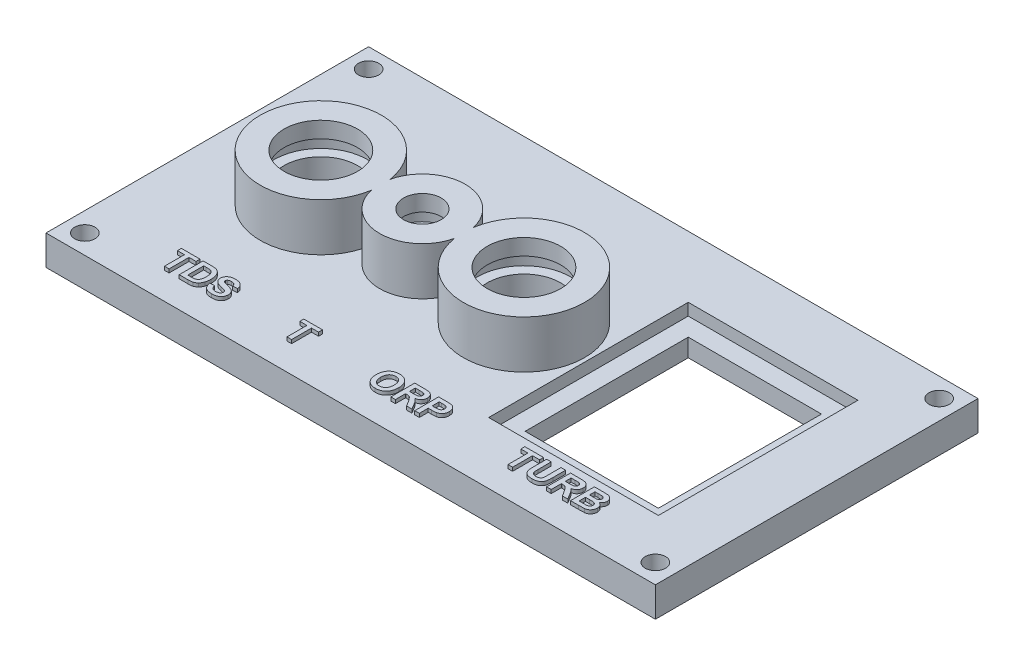
from build123d import *

# Parameters (mm, degrees)
SKETCH1_W                 = 102
SKETCH1_H                 = 54
CAP_PLATE_DEPTH           = 5
COLLAR_TDS_START          = 5
SKETCH2_R                 = 10.15
COLLAR_TDS_DEPTH          = 8
COLLAR_T_START            = 5
SKETCH3_R                 = 7.15
COLLAR_T_DEPTH            = 8
COLLAR_ORP_START          = 5
SKETCH4_R                 = 10.15
COLLAR_ORP_DEPTH          = 8
PORT_TDS_DEPTH            = 60.152345685
PORT_TDS_DEPTH_BACK       = 60.152345685
SKETCH5_R                 = 6.15
ORING_GROOVE_TDS_START    = 7.7
SKETCH6_R                 = 7.85
ORING_GROOVE_TDS_DEPTH    = 2.6
PORT_T_DEPTH              = 60.152345685
PORT_T_DEPTH_BACK         = 60.152345685
SKETCH7_R                 = 3.15
ORING_GROOVE_T_START      = 7.7
SKETCH8_R                 = 4.85
ORING_GROOVE_T_DEPTH      = 2.6
PORT_ORP_DEPTH            = 60.152345685
PORT_ORP_DEPTH_BACK       = 60.152345685
SKETCH9_R                 = 6.15
ORING_GROOVE_ORP_START    = 7.7
SKETCH10_R                = 7.85
ORING_GROOVE_ORP_DEPTH    = 2.6
PORT_TURB_DEPTH           = 60.152345685
PORT_TURB_DEPTH_BACK      = 60.152345685
SKETCH11_W                = 22.3
SKETCH11_H                = 27.3
TURB_GASKET_SEAT_START    = 5
SKETCH12_W                = 28.4
SKETCH12_H                = 33.4
TURB_GASKET_SEAT_DEPTH    = 2
SCREW_HOLES_M3_DEPTH      = 60.152345685
SCREW_HOLES_M3_DEPTH_BACK = 60.152345685
SKETCH13_R                = 1.7
LABEL_TDS_START           = 5
LABEL_TDS_DEPTH           = 0.6
LABEL_T_START             = 5
LABEL_T_DEPTH             = 0.6
LABEL_ORP_START           = 5
LABEL_ORP_DEPTH           = 0.6
LABEL_TURB_START          = 5
LABEL_TURB_DEPTH          = 0.6


with BuildPart() as part:
    # Sketch1 → Cap_Plate (new body)
    with BuildSketch(Plane(origin=(0, 0, 0), x_dir=(1, 0, 0), z_dir=(0, 1, 0))):
        Rectangle(SKETCH1_W, SKETCH1_H)
    extrude(amount=CAP_PLATE_DEPTH)

    # Sketch2 → Collar_TDS (add)
    with BuildSketch(Plane(origin=(0, 0, 0), x_dir=(1, 0, 0), z_dir=(0, 1, 0)).offset(COLLAR_TDS_START)):
        with Locations(Location((-32, 0, 0), (0, 0, 270))):
            Circle(SKETCH2_R)
    extrude(amount=COLLAR_TDS_DEPTH)

    # Sketch3 → Collar_T (add)
    with BuildSketch(Plane(origin=(0, 0, 0), x_dir=(1, 0, 0), z_dir=(0, 1, 0)).offset(COLLAR_T_START)):
        with Locations((-15, 0)):
            Circle(SKETCH3_R)
    extrude(amount=COLLAR_T_DEPTH)

    # Sketch4 → Collar_ORP (add)
    with BuildSketch(Plane(origin=(0, 0, 0), x_dir=(1, 0, 0), z_dir=(0, 1, 0)).offset(COLLAR_ORP_START)):
        with Locations((2, 0)):
            Circle(SKETCH4_R)
    extrude(amount=COLLAR_ORP_DEPTH)

    # Sketch5 → Port_TDS (cut, two sides: drawn at the far end of the back side and taken through both)
    with BuildSketch(Plane(origin=(0, 0, 0), x_dir=(1, 0, 0), z_dir=(0, 1, 0)).offset(-PORT_TDS_DEPTH_BACK)):
        with Locations(Location((-32, 0, 0), (0, 0, 270))):
            Circle(SKETCH5_R)
    extrude(amount=PORT_TDS_DEPTH + PORT_TDS_DEPTH_BACK, mode=Mode.SUBTRACT)

    # Sketch6 → ORing_Groove_TDS (cut)
    with BuildSketch(Plane(origin=(0, 0, 0), x_dir=(1, 0, 0), z_dir=(0, 1, 0)).offset(ORING_GROOVE_TDS_START)):
        with Locations(Location((-32, 0, 0), (0, 0, 270))):
            Circle(SKETCH6_R)
    extrude(amount=ORING_GROOVE_TDS_DEPTH, mode=Mode.SUBTRACT)

    # Sketch7 → Port_T (cut, two sides: drawn at the far end of the back side and taken through both)
    with BuildSketch(Plane(origin=(0, 0, 0), x_dir=(1, 0, 0), z_dir=(0, 1, 0)).offset(-PORT_T_DEPTH_BACK)):
        with Locations(Location((-15, 0, 0), (0, 0, 270))):
            Circle(SKETCH7_R)
    extrude(amount=PORT_T_DEPTH + PORT_T_DEPTH_BACK, mode=Mode.SUBTRACT)

    # Sketch8 → ORing_Groove_T (cut)
    with BuildSketch(Plane(origin=(0, 0, 0), x_dir=(1, 0, 0), z_dir=(0, 1, 0)).offset(ORING_GROOVE_T_START)):
        with Locations(Location((-15, 0, 0), (0, 0, 270))):
            Circle(SKETCH8_R)
    extrude(amount=ORING_GROOVE_T_DEPTH, mode=Mode.SUBTRACT)

    # Sketch9 → Port_ORP (cut, two sides: drawn at the far end of the back side and taken through both)
    with BuildSketch(Plane(origin=(0, 0, 0), x_dir=(1, 0, 0), z_dir=(0, 1, 0)).offset(-PORT_ORP_DEPTH_BACK)):
        with Locations(Location((2, 0, 0), (0, 0, 270))):
            Circle(SKETCH9_R)
    extrude(amount=PORT_ORP_DEPTH + PORT_ORP_DEPTH_BACK, mode=Mode.SUBTRACT)

    # Sketch10 → ORing_Groove_ORP (cut)
    with BuildSketch(Plane(origin=(0, 0, 0), x_dir=(1, 0, 0), z_dir=(0, 1, 0)).offset(ORING_GROOVE_ORP_START)):
        with Locations(Location((2, 0, 0), (0, 0, 270))):
            Circle(SKETCH10_R)
    extrude(amount=ORING_GROOVE_ORP_DEPTH, mode=Mode.SUBTRACT)

    # Sketch11 → Port_TURB (cut, two sides: drawn at the far end of the back side and taken through both)
    with BuildSketch(Plane(origin=(0, 0, 0), x_dir=(1, 0, 0), z_dir=(0, 1, 0)).offset(-PORT_TURB_DEPTH_BACK)):
        with Locations((27, 0)):
            Rectangle(SKETCH11_W, SKETCH11_H)
    extrude(amount=PORT_TURB_DEPTH + PORT_TURB_DEPTH_BACK, mode=Mode.SUBTRACT)

    # Sketch12 → TURB_Gasket_Seat (cut)
    with BuildSketch(Plane(origin=(0, 0, 0), x_dir=(1, 0, 0), z_dir=(0, 1, 0)).offset(TURB_GASKET_SEAT_START)):
        with Locations((27, 0)):
            Rectangle(SKETCH12_W, SKETCH12_H)
    extrude(amount=-TURB_GASKET_SEAT_DEPTH, mode=Mode.SUBTRACT)

    # Sketch13 → Screw_Holes_M3 (cut, two sides: drawn at the far end of the back side and taken through both)
    with BuildSketch(Plane(origin=(0, 0, 0), x_dir=(1, 0, 0), z_dir=(0, 1, 0)).offset(-SCREW_HOLES_M3_DEPTH_BACK)):
        with Locations(Location((-47.75, 23.75, 0), (0, 0, 270))):
            Circle(SKETCH13_R)
        with Locations(Location((-47.75, -23.75, 0), (0, 0, 270))):
            Circle(SKETCH13_R)
        with Locations(Location((47.75, 23.75, 0), (0, 0, 270))):
            Circle(SKETCH13_R)
        with Locations(Location((47.75, -23.75, 0), (0, 0, 270))):
            Circle(SKETCH13_R)
    extrude(amount=SCREW_HOLES_M3_DEPTH + SCREW_HOLES_M3_DEPTH_BACK, mode=Mode.SUBTRACT)

    # Sketch14 → Label_TDS (add)
    # profile 1 of 3: a face of its own
    with BuildSketch(Plane(origin=(0, 0, 0), x_dir=(1, 0, 0), z_dir=(0, 1, 0)).offset(LABEL_TDS_START)):
        Polygon((-35.666666667, -22.5), (-35.666666667, -19.166666667), (-36.846153846, -19.166666667), (-36.846153846, -18.5), (-33.717948718, -18.5), (-33.717948718, -19.166666667), (-34.897435897, -19.166666667), (-34.897435897, -22.5), align=None)
    # profile 2 of 3: a face of its own
    with BuildSketch(Plane(origin=(0, 0, 0), x_dir=(1, 0, 0), z_dir=(0, 1, 0)).offset(LABEL_TDS_START)):
        with BuildLine():
            Line((-33.205128205, -18.5), (-31.737980769, -18.5))
            add(Edge.make_bspline(
                [(-31.737980769, -18.5), (-31.697910591, -18.499979227), (-31.619884646, -18.499938778), (-31.506648571, -18.50463643), (-31.400758284, -18.509361651), (-31.302517715, -18.518820508), (-31.211586037, -18.528735069), (-31.127800077, -18.541287648), (-31.051689115, -18.557375153), (-31.003693585, -18.570062074), (-30.980769231, -18.576121795)],
                knots=[0, 0, 0, 0, 1.259756885, 2.453039283, 3.563158368, 4.591894114, 5.55549294, 6.43918076, 7.254497783, 8, 8, 8, 8], degree=3))
            add(Edge.make_bspline(
                [(-30.980769231, -18.576121795), (-30.952100925, -18.585465243), (-30.895280696, -18.603983842), (-30.811980494, -18.636431511), (-30.733057889, -18.676673164), (-30.655584948, -18.718974628), (-30.583020283, -18.768991188), (-30.51152363, -18.821026724), (-30.445735007, -18.881304449), (-30.359461689, -18.965546539), (-30.261017276, -19.082898434), (-30.157881751, -19.238559827), (-30.070587794, -19.40941962), (-30.010944549, -19.562504047), (-29.970671115, -19.69263874), (-29.94434481, -19.796973767), (-29.921982215, -19.90687741), (-29.903622456, -20.022377377), (-29.889357451, -20.143473684), (-29.878737004, -20.270134053), (-29.873563774, -20.402467902), (-29.87239247, -20.49251804), (-29.871794872, -20.538461538)],
                knots=[0, 0, 0, 0, 0.745524535, 1.477620414, 2.207090574, 2.934465325, 3.657932502, 4.384347339, 5.118673636, 5.861150177, 7.365375624, 8.894729774, 10.468936425, 12.099947606, 12.950091786, 13.83580991, 14.759228729, 15.722225242, 16.726454549, 17.773376212, 18.863978586, 20, 20, 20, 20], degree=3))
            add(Edge.make_bspline(
                [(-29.871794872, -20.538461538), (-29.872885763, -20.617866005), (-29.874995525, -20.771432649), (-29.899437251, -20.993028674), (-29.934660866, -21.198851171), (-29.974365187, -21.327252193), (-29.993589744, -21.389423077)],
                knots=[0, 0, 0, 0, 1.103207939, 2.133582005, 3.096293362, 4, 4, 4, 4], degree=3))
            add(Edge.make_bspline(
                [(-29.993589744, -21.389423077), (-30.006284321, -21.425098085), (-30.031256534, -21.495276392), (-30.074956036, -21.596508944), (-30.122173656, -21.692846691), (-30.173301045, -21.784213728), (-30.228596515, -21.870199086), (-30.28826689, -21.950545576), (-30.351387231, -22.026310986), (-30.397114267, -22.072944954), (-30.419871795, -22.096153846)],
                knots=[0, 0, 0, 0, 1.090884612, 2.145940218, 3.175104604, 4.181306866, 5.161203701, 6.118658341, 7.063689906, 8, 8, 8, 8], degree=3))
            add(Edge.make_bspline(
                [(-30.419871795, -22.096153846), (-30.456698973, -22.129272817), (-30.532641864, -22.197568856), (-30.666466244, -22.282087934), (-30.817725425, -22.356771314), (-30.927137068, -22.395134927), (-30.983974359, -22.415064103)],
                knots=[0, 0, 0, 0, 0.908140292, 1.872714733, 2.8949153, 4, 4, 4, 4], degree=3))
            add(Edge.make_bspline(
                [(-30.983974359, -22.415064103), (-31.006854253, -22.422091199), (-31.05434029, -22.436675575), (-31.129634084, -22.452251991), (-31.210012097, -22.468661898), (-31.296401201, -22.47854748), (-31.387904634, -22.488972263), (-31.485251594, -22.494825196), (-31.588104631, -22.498980438), (-31.658649006, -22.499655107), (-31.694711538, -22.5)],
                knots=[0, 0, 0, 0, 0.799129865, 1.658552685, 2.566799617, 3.538529252, 4.561352959, 5.643373779, 6.795284424, 8, 8, 8, 8], degree=3))
            Line((-31.694711538, -22.5), (-33.205128205, -22.5))
            Line((-33.205128205, -22.5), (-33.205128205, -18.5))
        make_face()
        with BuildLine():
            Line((-32.435897436, -19.166666667), (-32.435897436, -21.833333333))
            Line((-32.435897436, -21.833333333), (-31.802884615, -21.833333333))
            add(Edge.make_bspline(
                [(-31.802884615, -21.833333333), (-31.774305746, -21.833106683), (-31.719280505, -21.832670296), (-31.639657572, -21.831388023), (-31.566484766, -21.827916668), (-31.499378764, -21.82432091), (-31.438514268, -21.818380089), (-31.383626448, -21.812537065), (-31.335020835, -21.804362797), (-31.305000814, -21.797910138), (-31.290865385, -21.794871795)],
                knots=[0, 0, 0, 0, 1.333384787, 2.567275092, 3.714769766, 4.750907381, 5.701951617, 6.567520054, 7.325492842, 8, 8, 8, 8], degree=3))
            add(Edge.make_bspline(
                [(-31.290865385, -21.794871795), (-31.257758607, -21.786037264), (-31.193275336, -21.768829929), (-31.102734305, -21.730469825), (-31.020806336, -21.684192558), (-30.946119388, -21.628546133), (-30.878810988, -21.558221922), (-30.82135504, -21.46828277), (-30.768181074, -21.361017644), (-30.731767531, -21.258338093), (-30.705629958, -21.166627119), (-30.687936966, -21.089651835), (-30.673954673, -21.006372362), (-30.661928077, -20.917117374), (-30.652210302, -20.822001647), (-30.646163442, -20.720681703), (-30.642036423, -20.613281569), (-30.641368951, -20.539534109), (-30.641025641, -20.501602564)],
                knots=[0, 0, 0, 0, 1.038686998, 2.023088296, 2.974059649, 3.888265163, 4.839857954, 5.909819677, 7.113156087, 8.466843969, 9.20827164, 10.006482943, 10.861893492, 11.769681931, 12.739021491, 13.762258324, 14.849031541, 16, 16, 16, 16], degree=3))
            add(Edge.make_bspline(
                [(-30.641025641, -20.501602564), (-30.641366311, -20.463670902), (-30.642026253, -20.390190127), (-30.646146942, -20.283590818), (-30.652159836, -20.183866382), (-30.661946818, -20.090893542), (-30.673786982, -20.004543806), (-30.687933054, -19.924744099), (-30.70551939, -19.852018124), (-30.731679194, -19.765618322), (-30.771336109, -19.668502261), (-30.825301432, -19.562320812), (-30.891572705, -19.471819372), (-30.964796008, -19.393199293), (-31.049223715, -19.32849894), (-31.142684981, -19.274308626), (-31.247214727, -19.232248233), (-31.32157002, -19.214333332), (-31.359775641, -19.205128205)],
                knots=[0, 0, 0, 0, 1.117996097, 2.165769068, 3.143980016, 4.062055362, 4.920439205, 5.712587309, 6.449616741, 7.124491204, 8.371470382, 9.537068822, 10.625202851, 11.666538334, 12.693249444, 13.747832046, 14.842779399, 16, 16, 16, 16], degree=3))
            add(Edge.make_bspline(
                [(-31.359775641, -19.205128205), (-31.376312895, -19.202055352), (-31.412721599, -19.195290105), (-31.473138339, -19.187388257), (-31.544020637, -19.181524411), (-31.625729838, -19.175537939), (-31.717935093, -19.172121049), (-31.821022212, -19.16855497), (-31.934559823, -19.167336804), (-32.013889173, -19.166896465), (-32.055288462, -19.166666667)],
                knots=[0, 0, 0, 0, 0.578738571, 1.274160813, 2.095454135, 3.025967819, 4.093109015, 5.270126069, 6.575371698, 8, 8, 8, 8], degree=3))
            Line((-32.055288462, -19.166666667), (-32.435897436, -19.166666667))
        make_face(mode=Mode.SUBTRACT)
    # profile 3 of 3: a face of its own
    with BuildSketch(Plane(origin=(0, 0, 0), x_dir=(1, 0, 0), z_dir=(0, 1, 0)).offset(LABEL_TDS_START)):
        with BuildLine():
            Line((-29.41025641, -21.166666667), (-28.641025641, -21.115384615))
            add(Edge.make_bspline(
                [(-28.641025641, -21.115384615), (-28.634897397, -21.147566522), (-28.622993674, -21.210077828), (-28.596545835, -21.299164975), (-28.567434084, -21.382219461), (-28.532643946, -21.458350668), (-28.494557631, -21.528965837), (-28.450046335, -21.592053313), (-28.402215278, -21.649627318), (-28.34869673, -21.69962004), (-28.290388967, -21.743404357), (-28.227001039, -21.780745081), (-28.159219808, -21.813064152), (-28.086879541, -21.839677882), (-28.009234662, -21.859545162), (-27.92696157, -21.873679553), (-27.839942272, -21.882730827), (-27.780471511, -21.883976916), (-27.75, -21.884615385)],
                knots=[0, 0, 0, 0, 1.204560339, 2.339781841, 3.415289417, 4.440034832, 5.416475564, 6.362424008, 7.275913008, 8.16578645, 9.05021719, 9.95355393, 10.867835453, 11.809845306, 12.784702352, 13.812224031, 14.87903166, 16, 16, 16, 16], degree=3))
            add(Edge.make_bspline(
                [(-27.75, -21.884615385), (-27.717926807, -21.884265468), (-27.655542795, -21.883584862), (-27.565141463, -21.875141351), (-27.480612111, -21.863045113), (-27.402701164, -21.843897052), (-27.329953708, -21.822482975), (-27.264176489, -21.793186236), (-27.204305073, -21.759396683), (-27.150493703, -21.721054296), (-27.103532471, -21.678529837), (-27.062448441, -21.634135682), (-27.026666965, -21.588830946), (-26.998504411, -21.540605206), (-26.975712834, -21.491408909), (-26.960649197, -21.439774444), (-26.950472819, -21.386887451), (-26.949305885, -21.350742796), (-26.948717949, -21.332532051)],
                knots=[0, 0, 0, 0, 1.417779877, 2.757654889, 4.012140507, 5.189587551, 6.302846416, 7.360586765, 8.365575446, 9.33904572, 10.275781718, 11.161696098, 12.012180333, 12.822428111, 13.625933072, 14.403138519, 15.195454004, 16, 16, 16, 16], degree=3))
            add(Edge.make_bspline(
                [(-26.948717949, -21.332532051), (-26.949439002, -21.309715465), (-26.950849637, -21.265078153), (-26.967832275, -21.201264225), (-26.993300473, -21.142142465), (-27.03164678, -21.088586101), (-27.083193655, -21.03964339), (-27.14894683, -20.993858682), (-27.230741704, -20.952670351), (-27.29142286, -20.929695424), (-27.323717949, -20.917467949)],
                knots=[0, 0, 0, 0, 0.90494901, 1.770400303, 2.607161909, 3.452839393, 4.36912122, 5.420987164, 6.627424851, 8, 8, 8, 8], degree=3))
            add(Edge.make_bspline(
                [(-27.323717949, -20.917467949), (-27.337574916, -20.912824415), (-27.368584558, -20.902432941), (-27.421483716, -20.887574113), (-27.485202156, -20.869019384), (-27.560660651, -20.847928973), (-27.647833829, -20.826359034), (-27.745748078, -20.799787317), (-27.855597082, -20.773346287), (-27.932447577, -20.753827525), (-27.97275641, -20.743589744)],
                knots=[0, 0, 0, 0, 0.521821638, 1.167752076, 1.961721917, 2.891982557, 3.96540661, 5.168436773, 6.514817513, 8, 8, 8, 8], degree=3))
            add(Edge.make_bspline(
                [(-27.97275641, -20.743589744), (-28.025250474, -20.730483201), (-28.126529187, -20.70519627), (-28.270975823, -20.660212611), (-28.404013817, -20.615518856), (-28.524362228, -20.567023734), (-28.633348548, -20.518013888), (-28.729209892, -20.465048504), (-28.813946676, -20.410878263), (-28.863324766, -20.370390101), (-28.887019231, -20.350961538)],
                knots=[0, 0, 0, 0, 1.293880989, 2.496331788, 3.617634808, 4.64976062, 5.598842568, 6.473791081, 7.267636666, 8, 8, 8, 8], degree=3))
            add(Edge.make_bspline(
                [(-28.887019231, -20.350961538), (-28.916403447, -20.323449223), (-28.974013919, -20.269508786), (-29.049849165, -20.180874294), (-29.113571421, -20.087246136), (-29.166021814, -19.98931541), (-29.206407624, -19.886518334), (-29.235032567, -19.77954299), (-29.253559671, -19.668110183), (-29.255450234, -19.592221801), (-29.256410256, -19.553685897)],
                knots=[0, 0, 0, 0, 1.064429417, 2.086912298, 3.078678339, 4.055528992, 5.020032834, 5.993708893, 6.981211098, 8, 8, 8, 8], degree=3))
            add(Edge.make_bspline(
                [(-29.256410256, -19.553685897), (-29.254540605, -19.503820898), (-29.250831774, -19.404903623), (-29.216819378, -19.259508732), (-29.163837358, -19.11921386), (-29.102390778, -19.007814536), (-29.043353872, -18.923540527), (-28.99432802, -18.863066269), (-28.940468384, -18.806468177), (-28.881037203, -18.755126858), (-28.818241303, -18.706034956), (-28.74964773, -18.66244076), (-28.677201318, -18.621377439), (-28.572363107, -18.572698782), (-28.430021583, -18.52197084), (-28.244827614, -18.479210404), (-28.043188053, -18.453505859), (-27.903390725, -18.450352455), (-27.830929487, -18.448717949)],
                knots=[0, 0, 0, 0, 1.180131776, 2.341029169, 3.518901375, 4.725685298, 5.343762192, 5.955650671, 6.568945152, 7.192346361, 7.815201106, 8.455999361, 9.116257477, 9.787318263, 11.192748436, 12.688084276, 14.283332633, 16, 16, 16, 16], degree=3))
            add(Edge.make_bspline(
                [(-27.830929487, -18.448717949), (-27.771598165, -18.449511357), (-27.656200011, -18.45105452), (-27.488916982, -18.466659226), (-27.332665557, -18.490946107), (-27.18799404, -18.52580981), (-27.054835025, -18.571873913), (-26.932672348, -18.626744969), (-26.821609817, -18.691890681), (-26.72299951, -18.767684898), (-26.635147179, -18.851243161), (-26.558510069, -18.942513034), (-26.492795183, -19.040341837), (-26.437578405, -19.144658076), (-26.394216814, -19.255998089), (-26.362369438, -19.374222945), (-26.341305307, -19.499054373), (-26.336025518, -19.584590115), (-26.333333333, -19.628205128)],
                knots=[0, 0, 0, 0, 1.325124071, 2.577337985, 3.749592149, 4.855247722, 5.896868755, 6.892903601, 7.842551483, 8.766257401, 9.665194363, 10.546067736, 11.423174165, 12.293291263, 13.177512979, 14.086532529, 15.024315359, 16, 16, 16, 16], degree=3))
            Line((-26.333333333, -19.628205128), (-27.102564103, -19.679487179))
            add(Edge.make_bspline(
                [(-27.102564103, -19.679487179), (-27.107001601, -19.655366166), (-27.115649823, -19.608356818), (-27.134453426, -19.541029882), (-27.155662978, -19.478760145), (-27.18048766, -19.421548007), (-27.210472877, -19.370418192), (-27.243105409, -19.323762129), (-27.279285441, -19.282201483), (-27.320210906, -19.246874318), (-27.364475431, -19.214728047), (-27.414921389, -19.188962066), (-27.469435039, -19.165056907), (-27.530090295, -19.14708609), (-27.595722356, -19.132830992), (-27.666369452, -19.122263189), (-27.742178024, -19.117103393), (-27.794331528, -19.115970657), (-27.821314103, -19.115384615)],
                knots=[0, 0, 0, 0, 1.151066407, 2.24330871, 3.278475654, 4.238599069, 5.165719782, 6.056502506, 6.909492653, 7.744782051, 8.590364415, 9.471203867, 10.39832458, 11.382154319, 12.435022857, 13.550631277, 14.73277401, 16, 16, 16, 16], degree=3))
            add(Edge.make_bspline(
                [(-27.821314103, -19.115384615), (-27.849368612, -19.115901994), (-27.903949913, -19.116908577), (-27.983489417, -19.123085828), (-28.058103439, -19.134488439), (-28.12815843, -19.14933181), (-28.193560813, -19.16952519), (-28.254172569, -19.194147708), (-28.310271002, -19.223135992), (-28.344477381, -19.245942974), (-28.361378205, -19.257211538)],
                knots=[0, 0, 0, 0, 1.186678824, 2.308736671, 3.37120409, 4.377216403, 5.334874112, 6.262130804, 7.141346615, 8, 8, 8, 8], degree=3))
            add(Edge.make_bspline(
                [(-28.361378205, -19.257211538), (-28.38071978, -19.272604718), (-28.418178406, -19.302416529), (-28.458491815, -19.36161265), (-28.48276058, -19.428472893), (-28.485681602, -19.475754314), (-28.487179487, -19.5)],
                knots=[0, 0, 0, 0, 1.037857257, 2.010007357, 2.979541333, 4, 4, 4, 4], degree=3))
            add(Edge.make_bspline(
                [(-28.487179487, -19.5), (-28.48595449, -19.522659203), (-28.48354144, -19.567294227), (-28.459202724, -19.630699244), (-28.421773096, -19.689448553), (-28.386801247, -19.721361948), (-28.368589744, -19.737980769)],
                knots=[0, 0, 0, 0, 0.98538058, 1.941042925, 2.927803204, 4, 4, 4, 4], degree=3))
            add(Edge.make_bspline(
                [(-28.368589744, -19.737980769), (-28.354136569, -19.748767218), (-28.321839739, -19.772870441), (-28.26267835, -19.803507918), (-28.191269, -19.836690157), (-28.105983729, -19.869129458), (-28.007389341, -19.901508544), (-27.895479841, -19.935316053), (-27.770186398, -19.969577459), (-27.634702682, -20.002757953), (-27.497148552, -20.035372472), (-27.365884435, -20.071029347), (-27.243827683, -20.105792043), (-27.131544239, -20.142228989), (-27.0284553, -20.177700243), (-26.935061638, -20.214131775), (-26.850721975, -20.249612011), (-26.752372578, -20.298399849), (-26.640903428, -20.364484947), (-26.524071185, -20.460550658), (-26.420747974, -20.568534792), (-26.348755106, -20.670356382), (-26.299299773, -20.757925658), (-26.267455757, -20.827728568), (-26.239908185, -20.901283234), (-26.217484537, -20.97867094), (-26.201232787, -21.060000579), (-26.187783519, -21.144650792), (-26.180912038, -21.233324619), (-26.179967244, -21.293793859), (-26.179487179, -21.324519231)],
                knots=[0, 0, 0, 0, 0.511875881, 1.143829537, 1.88775736, 2.750598373, 3.734912702, 4.837306479, 6.073130119, 7.42648979, 8.801963576, 10.091065733, 11.292408984, 12.408830014, 13.446061236, 14.39066453, 15.257936293, 16.045629259, 17.510392066, 18.929669597, 20.331293837, 21.746891395, 22.460690638, 23.187651344, 23.925159671, 24.69163991, 25.474819891, 26.281170188, 27.126635539, 28, 28, 28, 28], degree=3))
            add(Edge.make_bspline(
                [(-26.179487179, -21.324519231), (-26.180147284, -21.352854893), (-26.181458187, -21.409126773), (-26.190619134, -21.492648449), (-26.204786308, -21.574686934), (-26.225758594, -21.655345075), (-26.253580471, -21.734464198), (-26.284905693, -21.813186212), (-26.32407612, -21.889794355), (-26.368657409, -21.964352078), (-26.417832596, -22.03680343), (-26.473557216, -22.103638152), (-26.532558224, -22.167086011), (-26.598605626, -22.223594281), (-26.667620848, -22.277738468), (-26.742760574, -22.325689471), (-26.82226439, -22.369080883), (-26.906634984, -22.407588743), (-26.996171498, -22.441144863), (-27.090757641, -22.471012143), (-27.191245578, -22.495456217), (-27.296797384, -22.516407868), (-27.407799329, -22.532341057), (-27.524112638, -22.543466128), (-27.645763753, -22.549739997), (-27.728625488, -22.550761647), (-27.770833333, -22.551282051)],
                knots=[0, 0, 0, 0, 0.900570041, 1.788444861, 2.667795364, 3.545012114, 4.433698372, 5.332345486, 6.235991676, 7.164928091, 8.092777575, 9.015680987, 9.928493428, 10.842962589, 11.775229507, 12.714851019, 13.672254427, 14.652424454, 15.660007982, 16.709910502, 17.803296389, 18.945495772, 20.129342395, 21.366102753, 22.658353839, 24, 24, 24, 24], degree=3))
            add(Edge.make_bspline(
                [(-27.770833333, -22.551282051), (-27.83177495, -22.550287076), (-27.950429723, -22.548349835), (-28.122813797, -22.531010004), (-28.284498648, -22.504470143), (-28.435221062, -22.465951852), (-28.575165262, -22.41650306), (-28.704267418, -22.355593067), (-28.821903079, -22.282857968), (-28.929529226, -22.200061712), (-29.025711908, -22.105695542), (-29.11219957, -22.00171469), (-29.187825469, -21.887182825), (-29.252539895, -21.762279091), (-29.307978942, -21.627678715), (-29.353700057, -21.483319892), (-29.388125655, -21.328514106), (-29.402751908, -21.221548863), (-29.41025641, -21.166666667)],
                knots=[0, 0, 0, 0, 1.217954099, 2.371385517, 3.459848295, 4.490682126, 5.476952527, 6.422732854, 7.338496285, 8.236688651, 9.131557988, 10.026443255, 10.935708282, 11.869506048, 12.834296687, 13.842423496, 14.892981177, 16, 16, 16, 16], degree=3))
        make_face()
    extrude(amount=LABEL_TDS_DEPTH)

    # Sketch15 → Label_T (add)
    with BuildSketch(Plane(origin=(0, 0, 0), x_dir=(1, 0, 0), z_dir=(0, 1, 0)).offset(LABEL_T_START)):
        Polygon((-15.166666667, -22.5), (-15.166666667, -19.166666667), (-16.346153846, -19.166666667), (-16.346153846, -18.5), (-13.217948718, -18.5), (-13.217948718, -19.166666667), (-14.397435897, -19.166666667), (-14.397435897, -22.5), align=None)
    extrude(amount=LABEL_T_DEPTH)

    # Sketch16 → Label_ORP (add)
    # profile 1 of 3: a face of its own
    with BuildSketch(Plane(origin=(0, 0, 0), x_dir=(1, 0, 0), z_dir=(0, 1, 0)).offset(LABEL_ORP_START)):
        with BuildLine():
            add(Edge.make_bspline(
                [(-2.243589744, -20.524038462), (-2.24330668, -20.474608112), (-2.242750779, -20.377533287), (-2.233118314, -20.235120874), (-2.220421974, -20.098613259), (-2.199746005, -19.968547376), (-2.175423517, -19.844314473), (-2.14500254, -19.725951427), (-2.108356035, -19.613873332), (-2.07920345, -19.54231268), (-2.064903846, -19.507211538)],
                knots=[0, 0, 0, 0, 1.141009212, 2.240794809, 3.294380675, 4.305229195, 5.280013876, 6.216333343, 7.125095522, 8, 8, 8, 8], degree=3))
            add(Edge.make_bspline(
                [(-2.064903846, -19.507211538), (-2.04152942, -19.457311201), (-1.99505549, -19.358097434), (-1.908746097, -19.217900407), (-1.810919489, -19.08568325), (-1.702381046, -18.962139102), (-1.585901788, -18.849127849), (-1.460932221, -18.752406489), (-1.331912137, -18.668708535), (-1.240149567, -18.62661344), (-1.194711538, -18.605769231)],
                knots=[0, 0, 0, 0, 1.031372299, 2.050613973, 3.077158538, 4.108712802, 5.127684358, 6.111366908, 7.06480644, 8, 8, 8, 8], degree=3))
            add(Edge.make_bspline(
                [(-1.194711538, -18.605769231), (-1.163868375, -18.593118053), (-1.101526477, -18.567546798), (-1.004639829, -18.535632531), (-0.904077028, -18.509703632), (-0.800565437, -18.486526217), (-0.693100047, -18.470544626), (-0.582549221, -18.457144612), (-0.468307954, -18.450121432), (-0.391033712, -18.449190865), (-0.351762821, -18.448717949)],
                knots=[0, 0, 0, 0, 0.92659354, 1.872881803, 2.832850937, 3.813025581, 4.820167273, 5.851730198, 6.908245912, 8, 8, 8, 8], degree=3))
            add(Edge.make_bspline(
                [(-0.351762821, -18.448717949), (-0.281445249, -18.450480579), (-0.143832795, -18.453930072), (0.057180357, -18.478845345), (0.247399832, -18.520917077), (0.426181732, -18.581726325), (0.595067461, -18.657739204), (0.752744876, -18.752024525), (0.899447344, -18.863561831), (1.034891516, -18.99082159), (1.156868694, -19.133582017), (1.263100683, -19.290509519), (1.35221496, -19.460868719), (1.425605712, -19.644189587), (1.482000974, -19.841070908), (1.522746499, -20.050957161), (1.546952639, -20.274002945), (1.549813029, -20.427022232), (1.551282051, -20.505608974)],
                knots=[0, 0, 0, 0, 1.064641025, 2.083517118, 3.061799897, 4.009540929, 4.938075217, 5.861300345, 6.78508344, 7.723570974, 8.670267188, 9.622657076, 10.586935816, 11.576069104, 12.607749008, 13.683335114, 14.81022093, 16, 16, 16, 16], degree=3))
            add(Edge.make_bspline(
                [(1.551282051, -20.505608974), (1.549846959, -20.583669488), (1.547053103, -20.735638725), (1.52239514, -20.956934259), (1.483338865, -21.165290436), (1.425579061, -21.360231293), (1.354378715, -21.543244361), (1.264347431, -21.712149806), (1.16034026, -21.86918805), (1.038536328, -22.010410123), (0.905371758, -22.138400225), (0.758855375, -22.248633941), (0.602325774, -22.343047013), (0.434360842, -22.419279558), (0.256055343, -22.47883646), (0.066827391, -22.521231483), (-0.133420066, -22.546050879), (-0.270496339, -22.549512896), (-0.340544872, -22.551282051)],
                knots=[0, 0, 0, 0, 1.18845052, 2.313691126, 3.386664782, 4.412527756, 5.405809582, 6.372003093, 7.321919452, 8.268293321, 9.206237639, 10.129603466, 11.054616372, 11.9847576, 12.932764752, 13.912672021, 14.933336461, 16, 16, 16, 16], degree=3))
            add(Edge.make_bspline(
                [(-0.340544872, -22.551282051), (-0.411393543, -22.549508814), (-0.550064745, -22.546038078), (-0.752448028, -22.52129423), (-0.94355439, -22.478885252), (-1.123247746, -22.419118857), (-1.292753638, -22.344044378), (-1.450507084, -22.250596071), (-1.596595285, -22.139664224), (-1.730872522, -22.013180678), (-1.852601139, -21.872373801), (-1.956460633, -21.716345269), (-2.046496613, -21.549089607), (-2.118071295, -21.368073293), (-2.175513036, -21.175158752), (-2.214664749, -20.969235937), (-2.239370392, -20.750871605), (-2.242157586, -20.601031531), (-2.243589744, -20.524038462)],
                knots=[0, 0, 0, 0, 1.080878253, 2.11558926, 3.1052859, 4.062802436, 5.000434901, 5.928596448, 6.853693179, 7.793554778, 8.738606028, 9.68692032, 10.647726704, 11.63151566, 12.651483354, 13.714466703, 14.825613081, 16, 16, 16, 16], degree=3))
        make_face()
        with BuildLine():
            add(Edge.make_bspline(
                [(-1.474358974, -20.497596154), (-1.473590522, -20.552926721), (-1.47210243, -20.660073313), (-1.456252274, -20.815593997), (-1.432198388, -20.960984026), (-1.396823615, -21.096078385), (-1.352134322, -21.220974806), (-1.297380675, -21.335777762), (-1.232788947, -21.440658241), (-1.156688471, -21.533402068), (-1.074353723, -21.616204428), (-0.985480707, -21.687849353), (-0.891725705, -21.749514577), (-0.79146647, -21.798199063), (-0.686789576, -21.836835528), (-0.576881757, -21.865483053), (-0.461196525, -21.881213357), (-0.382256134, -21.883469211), (-0.342147436, -21.884615385)],
                knots=[0, 0, 0, 0, 1.313550922, 2.543666373, 3.708465049, 4.810029406, 5.85539231, 6.85404609, 7.825601258, 8.772642133, 9.696587791, 10.59409323, 11.479048685, 12.35559886, 13.234601248, 14.125357077, 15.047515647, 16, 16, 16, 16], degree=3))
            add(Edge.make_bspline(
                [(-0.342147436, -21.884615385), (-0.302033334, -21.883492434), (-0.223082308, -21.881282287), (-0.107539219, -21.865230356), (0.002586409, -21.837810725), (0.106847452, -21.799372249), (0.205719119, -21.749914713), (0.299115292, -21.689631894), (0.386497612, -21.617661016), (0.46874274, -21.536061566), (0.542789082, -21.442701745), (0.606830863, -21.337839365), (0.661557534, -21.222340126), (0.706251533, -21.096160819), (0.740755725, -20.959064039), (0.763827914, -20.810977248), (0.779806241, -20.652323872), (0.781288264, -20.542777837), (0.782051282, -20.486378205)],
                knots=[0, 0, 0, 0, 0.949153107, 1.868086493, 2.754172764, 3.630100905, 4.492260106, 5.365378617, 6.254840125, 7.166615376, 8.102436631, 9.067266169, 10.06813181, 11.121736829, 12.23011542, 13.408501285, 14.665770308, 16, 16, 16, 16], degree=3))
            add(Edge.make_bspline(
                [(0.782051282, -20.486378205), (0.781189444, -20.430523142), (0.779520412, -20.322354504), (0.76498487, -20.165703978), (0.741178338, -20.019964691), (0.708084627, -19.885174396), (0.664349209, -19.761311374), (0.612112371, -19.64803691), (0.548950615, -19.545942801), (0.476511819, -19.455081907), (0.396354956, -19.375106803), (0.309841864, -19.305092026), (0.216481005, -19.246835475), (0.117183568, -19.197820491), (0.010915761, -19.161456453), (-0.101242485, -19.13493283), (-0.219608571, -19.118599543), (-0.300695255, -19.116472154), (-0.342147436, -19.115384615)],
                knots=[0, 0, 0, 0, 1.332337092, 2.580197383, 3.749299508, 4.852775005, 5.886662144, 6.878700295, 7.822989687, 8.743523536, 9.644687758, 10.519443927, 11.392806431, 12.264866173, 13.155606721, 14.065961015, 15.011303331, 16, 16, 16, 16], degree=3))
            add(Edge.make_bspline(
                [(-0.342147436, -19.115384615), (-0.383604856, -19.116455425), (-0.46470179, -19.11855009), (-0.583252381, -19.135153799), (-0.695763961, -19.160887085), (-0.802016748, -19.199327514), (-0.902179098, -19.247871799), (-0.995880538, -19.308076388), (-1.083859406, -19.377972344), (-1.164734451, -19.459160055), (-1.238346983, -19.550816605), (-1.301539157, -19.654158201), (-1.355424368, -19.768056224), (-1.39963406, -19.892847821), (-1.432407113, -20.028876288), (-1.457595932, -20.17522743), (-1.471741038, -20.33278705), (-1.473467573, -20.441479056), (-1.474358974, -20.497596154)],
                knots=[0, 0, 0, 0, 0.981996942, 1.920933313, 2.83127778, 3.712125466, 4.592427284, 5.463259035, 6.34592384, 7.249932058, 8.173122297, 9.125107726, 10.113123258, 11.154048744, 12.256187849, 13.424658091, 14.670364834, 16, 16, 16, 16], degree=3))
        make_face(mode=Mode.SUBTRACT)
    # profile 2 of 3: a face of its own
    with BuildSketch(Plane(origin=(0, 0, 0), x_dir=(1, 0, 0), z_dir=(0, 1, 0)).offset(LABEL_ORP_START)):
        with BuildLine():
            Line((2.217948718, -22.5), (2.217948718, -18.5))
            Line((2.217948718, -18.5), (3.896634615, -18.5))
            add(Edge.make_bspline(
                [(3.896634615, -18.5), (3.947651539, -18.500314416), (4.045970488, -18.500920354), (4.18815887, -18.505338971), (4.319288475, -18.51459623), (4.439940996, -18.525080153), (4.549536929, -18.540333585), (4.648509597, -18.558607046), (4.736692374, -18.579783469), (4.815371896, -18.605145668), (4.887111638, -18.634173587), (4.953940727, -18.668724977), (5.016593969, -18.709206177), (5.076033657, -18.754221912), (5.132511493, -18.803841349), (5.184479155, -18.859377664), (5.232842057, -18.920003904), (5.277561178, -18.985215655), (5.316955924, -19.054724967), (5.352952379, -19.126299533), (5.382254851, -19.200701015), (5.406458427, -19.277578925), (5.425792617, -19.356766352), (5.439212178, -19.438464618), (5.447589865, -19.522525849), (5.448337743, -19.579306772), (5.448717949, -19.608173077)],
                knots=[0, 0, 0, 0, 1.675828044, 3.229627355, 4.67171229, 5.993455049, 7.206927059, 8.304770529, 9.29850117, 10.183580433, 11.017754134, 11.837875825, 12.650738409, 13.464925643, 14.285328857, 15.117007378, 15.959673368, 16.830859064, 17.711229498, 18.58228265, 19.460420693, 20.334473227, 21.228207035, 22.135446768, 23.052097822, 24, 24, 24, 24], degree=3))
            add(Edge.make_bspline(
                [(5.448717949, -19.608173077), (5.448012723, -19.644536541), (5.446634519, -19.715600774), (5.433951552, -19.819758822), (5.415114107, -19.919274402), (5.388261475, -20.014285384), (5.351339653, -20.103674303), (5.30847793, -20.188693371), (5.257358124, -20.2690542), (5.198327541, -20.343960137), (5.131439026, -20.413477489), (5.056399448, -20.476175641), (4.973744567, -20.532299633), (4.882974371, -20.58152582), (4.784720898, -20.623608876), (4.678558088, -20.659016277), (4.564966541, -20.687833956), (4.485952323, -20.701393536), (4.445512821, -20.708333333)],
                knots=[0, 0, 0, 0, 1.05911256, 2.069797862, 3.05271628, 4.008392045, 4.940519534, 5.866323021, 6.779546087, 7.71056835, 8.640711998, 9.585328432, 10.554502533, 11.547017206, 12.589327225, 13.664782803, 14.804835066, 16, 16, 16, 16], degree=3))
            add(Edge.make_bspline(
                [(4.445512821, -20.708333333), (4.484622361, -20.73423595), (4.56116506, -20.7849309), (4.667067395, -20.868426117), (4.762142563, -20.956060805), (4.834128685, -21.033991022), (4.889442601, -21.102522275), (4.933979754, -21.162460371), (4.982020213, -21.231440424), (5.033092807, -21.30949981), (5.08870737, -21.39594789), (5.146795496, -21.492107883), (5.208572764, -21.59704183), (5.250108184, -21.670343505), (5.271634615, -21.708333333)],
                knots=[0, 0, 0, 0, 1.285445069, 2.515791127, 3.691898215, 4.826622834, 5.420063933, 6.105349801, 6.873086501, 7.723915395, 8.66222816, 9.690593598, 10.803111229, 12, 12, 12, 12], degree=3))
            Line((5.271634615, -21.708333333), (5.756410256, -22.5))
            Line((5.756410256, -22.5), (4.857371795, -22.5))
            Line((4.857371795, -22.5), (4.288461538, -21.592147436))
            add(Edge.make_bspline(
                [(4.288461538, -21.592147436), (4.262333788, -21.555788596), (4.212450541, -21.486372096), (4.140440991, -21.387728996), (4.074558644, -21.299918919), (4.016556849, -21.221669989), (3.963500739, -21.155200746), (3.917001309, -21.099352861), (3.878005693, -21.052927919), (3.833882056, -21.006895587), (3.782548889, -20.95958717), (3.719002529, -20.913718968), (3.653746312, -20.877153321), (3.583829488, -20.849252873), (3.502972794, -20.829798827), (3.405770243, -20.817404127), (3.28916556, -20.808259456), (3.204883735, -20.807890941), (3.159455128, -20.807692308)],
                knots=[0, 0, 0, 0, 1.465447777, 2.797841088, 3.997266218, 5.05856206, 5.985598736, 6.780315439, 7.437430484, 7.969193402, 8.866571936, 9.718200644, 10.52825214, 11.309096006, 12.174169268, 13.242355782, 14.513606761, 16, 16, 16, 16], degree=3))
            Line((3.159455128, -20.807692308), (2.987179487, -20.807692308))
            Line((2.987179487, -20.807692308), (2.987179487, -22.5))
            Line((2.987179487, -22.5), (2.217948718, -22.5))
        make_face()
        with BuildLine():
            Line((2.987179487, -20.141025641), (3.606570513, -20.141025641))
            add(Edge.make_bspline(
                [(3.606570513, -20.141025641), (3.65438265, -20.140923177), (3.745472851, -20.140727965), (3.875004929, -20.1379004), (3.990720692, -20.135500482), (4.091927666, -20.129470586), (4.179078662, -20.123494391), (4.251824071, -20.115727506), (4.310776794, -20.106547299), (4.369660656, -20.092274486), (4.429977738, -20.067406928), (4.494264334, -20.031988205), (4.549208498, -19.986040516), (4.596802834, -19.932920342), (4.633110645, -19.870472745), (4.661548248, -19.801479838), (4.675966715, -19.724408536), (4.678289103, -19.670988087), (4.679487179, -19.643429487)],
                knots=[0, 0, 0, 0, 1.697953026, 3.23488743, 4.60134403, 5.807846676, 6.835100678, 7.703488618, 8.405232423, 8.952775585, 9.851109663, 10.713519226, 11.549115941, 12.382556273, 13.233359028, 14.101746968, 15.020727134, 16, 16, 16, 16], degree=3))
            add(Edge.make_bspline(
                [(4.679487179, -19.643429487), (4.678124593, -19.612599495), (4.675495702, -19.553117997), (4.654763896, -19.468475259), (4.618577371, -19.393705053), (4.568879539, -19.328683932), (4.50649174, -19.27377916), (4.432180972, -19.230196722), (4.346499312, -19.19773833), (4.284700166, -19.185751509), (4.252403846, -19.179487179)],
                knots=[0, 0, 0, 0, 1.062977961, 2.050844577, 2.982300261, 3.90936959, 4.856017476, 5.831122378, 6.86654153, 8, 8, 8, 8], degree=3))
            add(Edge.make_bspline(
                [(4.252403846, -19.179487179), (4.241728265, -19.178314162), (4.216424896, -19.175533866), (4.171742145, -19.173748204), (4.114609517, -19.171003446), (4.044335477, -19.169881725), (3.961547849, -19.167915447), (3.865917433, -19.167554388), (3.757748055, -19.166400832), (3.6813573, -19.166574812), (3.641025641, -19.166666667)],
                knots=[0, 0, 0, 0, 0.42127143, 0.998501726, 1.753681744, 2.66564073, 3.755712164, 5.002818897, 6.417592707, 8, 8, 8, 8], degree=3))
            Line((3.641025641, -19.166666667), (2.987179487, -19.166666667))
            Line((2.987179487, -19.166666667), (2.987179487, -20.141025641))
        make_face(mode=Mode.SUBTRACT)
    # profile 3 of 3: a face of its own
    with BuildSketch(Plane(origin=(0, 0, 0), x_dir=(1, 0, 0), z_dir=(0, 1, 0)).offset(LABEL_ORP_START)):
        with BuildLine():
            Line((6.217948718, -22.5), (6.217948718, -18.5))
            Line((6.217948718, -18.5), (7.497596154, -18.5))
            add(Edge.make_bspline(
                [(7.497596154, -18.5), (7.55555745, -18.500063296), (7.66641532, -18.500184359), (7.824547365, -18.503547969), (7.966921581, -18.50830953), (8.093326662, -18.514239853), (8.204207393, -18.523089035), (8.299066377, -18.533336253), (8.378500934, -18.544359541), (8.425277592, -18.55576717), (8.446314103, -18.560897436)],
                knots=[0, 0, 0, 0, 1.460485487, 2.793352117, 3.985295279, 5.050041172, 5.981765236, 6.787433016, 7.454681457, 8, 8, 8, 8], degree=3))
            add(Edge.make_bspline(
                [(8.446314103, -18.560897436), (8.474287547, -18.568873743), (8.529808279, -18.584704843), (8.609352176, -18.618454235), (8.686019896, -18.657567979), (8.758848192, -18.704184492), (8.828084631, -18.757476166), (8.893935015, -18.8170084), (8.956750514, -18.883049937), (9.015662157, -18.955470313), (9.069618292, -19.033904349), (9.116249949, -19.118468007), (9.155317527, -19.208793731), (9.188602455, -19.304202733), (9.213160233, -19.405717952), (9.230346213, -19.512634051), (9.2423098, -19.624997791), (9.243156859, -19.70189037), (9.243589744, -19.741185897)],
                knots=[0, 0, 0, 0, 0.907145743, 1.80047177, 2.69161667, 3.591261238, 4.495029544, 5.415863088, 6.359363025, 7.337192411, 8.326890979, 9.326929023, 10.346104993, 11.395420813, 12.477187422, 13.601053412, 14.774031606, 16, 16, 16, 16], degree=3))
            add(Edge.make_bspline(
                [(9.243589744, -19.741185897), (9.242355158, -19.800860624), (9.239978514, -19.915737748), (9.213388082, -20.08042803), (9.172831131, -20.230861986), (9.113554218, -20.365590624), (9.041283346, -20.485142643), (8.961675493, -20.592918223), (8.870775023, -20.685668899), (8.772565084, -20.764891497), (8.668775129, -20.829723985), (8.564797292, -20.88499276), (8.459228545, -20.927485161), (8.387252009, -20.945999441), (8.351762821, -20.955128205)],
                knots=[0, 0, 0, 0, 1.312386234, 2.526415563, 3.661883817, 4.733421185, 5.753802465, 6.732107337, 7.675884281, 8.604170108, 9.50284679, 10.365392406, 11.194030444, 12, 12, 12, 12], degree=3))
            add(Edge.make_bspline(
                [(8.351762821, -20.955128205), (8.326432378, -20.959946651), (8.273038828, -20.970103359), (8.188359852, -20.980227748), (8.095801142, -20.991434343), (7.994981997, -20.998743914), (7.886024383, -21.005589021), (7.768970609, -21.008820822), (7.643987956, -21.012714485), (7.557963259, -21.01278445), (7.513621795, -21.012820513)],
                knots=[0, 0, 0, 0, 0.735353946, 1.55003838, 2.431865514, 3.394945452, 4.432993119, 5.54609699, 6.735134699, 8, 8, 8, 8], degree=3))
            Line((7.513621795, -21.012820513), (6.987179487, -21.012820513))
            Line((6.987179487, -21.012820513), (6.987179487, -22.5))
            Line((6.987179487, -22.5), (6.217948718, -22.5))
        make_face()
        with BuildLine():
            Line((6.987179487, -19.166666667), (6.987179487, -20.346153846))
            Line((6.987179487, -20.346153846), (7.448717949, -20.346153846))
            add(Edge.make_bspline(
                [(7.448717949, -20.346153846), (7.488518453, -20.346102308), (7.564661825, -20.346003709), (7.673910673, -20.342464574), (7.772802833, -20.338144404), (7.861544939, -20.330993639), (7.939601318, -20.321569102), (8.007494695, -20.310296168), (8.065304198, -20.298199133), (8.127817305, -20.278152406), (8.194656316, -20.245718631), (8.266032524, -20.199103149), (8.328736438, -20.143368842), (8.380914407, -20.077910829), (8.422593051, -20.005183185), (8.452434991, -19.925931245), (8.471703903, -19.841468492), (8.473463942, -19.782958954), (8.474358974, -19.753205128)],
                knots=[0, 0, 0, 0, 1.411705958, 2.700771114, 3.876961699, 4.922619712, 5.858038221, 6.66485904, 7.363650596, 7.950905807, 8.989198271, 9.987739806, 10.967313358, 11.951275539, 12.944273208, 13.927870418, 14.946261014, 16, 16, 16, 16], degree=3))
            add(Edge.make_bspline(
                [(8.474358974, -19.753205128), (8.473099315, -19.716965434), (8.470657002, -19.646701444), (8.443725103, -19.546633796), (8.402172261, -19.455821192), (8.342763495, -19.377089223), (8.270999103, -19.310882111), (8.190338922, -19.255795441), (8.099060416, -19.217245369), (8.0344597, -19.202308639), (8.001602564, -19.194711538)],
                knots=[0, 0, 0, 0, 1.085904563, 2.105425768, 3.088705091, 4.068969419, 5.045188284, 6.010769642, 6.988240112, 8, 8, 8, 8], degree=3))
            add(Edge.make_bspline(
                [(8.001602564, -19.194711538), (7.987463388, -19.192450092), (7.9560788, -19.187430384), (7.903911228, -19.182191693), (7.842196981, -19.177427109), (7.770861671, -19.173515244), (7.690188051, -19.17045707), (7.599910024, -19.167777357), (7.500265355, -19.167562077), (7.430554903, -19.166973406), (7.394230769, -19.166666667)],
                knots=[0, 0, 0, 0, 0.564603001, 1.253243608, 2.066786758, 3.005752288, 4.070476343, 5.250658742, 6.567396469, 8, 8, 8, 8], degree=3))
            Line((7.394230769, -19.166666667), (6.987179487, -19.166666667))
        make_face(mode=Mode.SUBTRACT)
    extrude(amount=LABEL_ORP_DEPTH)

    # Sketch17 → Label_TURB (add)
    # profile 1 of 4: a face of its own
    with BuildSketch(Plane(origin=(0, 0, 0), x_dir=(1, 0, 0), z_dir=(0, 1, 0)).offset(LABEL_TURB_START)):
        Polygon((21.833333333, -22.5), (21.833333333, -19.166666667), (20.653846154, -19.166666667), (20.653846154, -18.5), (23.782051282, -18.5), (23.782051282, -19.166666667), (22.602564103, -19.166666667), (22.602564103, -22.5), align=None)
    # profile 2 of 4: a face of its own
    with BuildSketch(Plane(origin=(0, 0, 0), x_dir=(1, 0, 0), z_dir=(0, 1, 0)).offset(LABEL_TURB_START)):
        with BuildLine():
            Line((24.294871795, -18.5), (25.064102564, -18.5))
            Line((25.064102564, -18.5), (25.064102564, -20.670673077))
            add(Edge.make_bspline(
                [(25.064102564, -20.670673077), (25.064396228, -20.71180551), (25.06495686, -20.79033123), (25.065342775, -20.902520298), (25.067478473, -21.003248729), (25.072109944, -21.092678832), (25.07528865, -21.170764998), (25.081191162, -21.23752156), (25.08707937, -21.292922519), (25.092804121, -21.325875468), (25.095352564, -21.340544872)],
                knots=[0, 0, 0, 0, 1.470600056, 2.807515117, 4.011048972, 5.072079398, 6.00911328, 6.804506435, 7.467811572, 8, 8, 8, 8], degree=3))
            add(Edge.make_bspline(
                [(25.095352564, -21.340544872), (25.105859161, -21.380091441), (25.126547976, -21.457963628), (25.18357396, -21.564412841), (25.258904479, -21.658241119), (25.335744386, -21.725155784), (25.405252, -21.772513019), (25.464293024, -21.801335315), (25.526935164, -21.827608691), (25.594502709, -21.847768031), (25.666270484, -21.865408178), (25.743105366, -21.875607834), (25.824358916, -21.883435817), (25.88005305, -21.884215164), (25.908653846, -21.884615385)],
                knots=[0, 0, 0, 0, 1.376921055, 2.711331395, 4.038631339, 5.418057255, 6.132954575, 6.870556231, 7.630397752, 8.422890386, 9.247036838, 10.121396817, 11.035274583, 12, 12, 12, 12], degree=3))
            add(Edge.make_bspline(
                [(25.908653846, -21.884615385), (25.937508922, -21.884092044), (25.993689167, -21.88307311), (26.075103932, -21.877005002), (26.151062516, -21.865556576), (26.221518452, -21.850545477), (26.286843863, -21.831573965), (26.346517594, -21.8075538), (26.400445608, -21.778647709), (26.463810211, -21.735079087), (26.531990441, -21.67361794), (26.597605207, -21.59005366), (26.644565183, -21.497807785), (26.666591401, -21.413580401), (26.677912138, -21.340195668), (26.684809339, -21.275981478), (26.691117179, -21.203313296), (26.69684518, -21.122390159), (26.700762398, -21.033151325), (26.702881152, -20.935371103), (26.704548623, -20.829065087), (26.704930406, -20.755342601), (26.705128205, -20.717147436)],
                knots=[0, 0, 0, 0, 1.036876239, 2.018776863, 2.930845756, 3.794842666, 4.605604932, 5.371924355, 6.101864688, 6.799283669, 8.1310906, 9.382718023, 10.597336334, 11.822035891, 12.492591141, 13.265194674, 14.141890321, 15.11351293, 16.179860579, 17.351049011, 18.627594861, 20, 20, 20, 20], degree=3))
            Line((26.705128205, -20.717147436), (26.705128205, -18.5))
            Line((26.705128205, -18.5), (27.474358974, -18.5))
            Line((27.474358974, -18.5), (27.474358974, -20.592147436))
            add(Edge.make_bspline(
                [(27.474358974, -20.592147436), (27.47426038, -20.649840321), (27.474070935, -20.760695614), (27.471113008, -20.920188723), (27.464826474, -21.066516964), (27.459562044, -21.199931166), (27.449407175, -21.320090976), (27.438775062, -21.427071103), (27.42507848, -21.520852851), (27.405547026, -21.627449437), (27.372723148, -21.747043948), (27.319822342, -21.879151423), (27.252213522, -21.999340946), (27.170166095, -22.108073673), (27.074152721, -22.205781764), (26.962735802, -22.292081097), (26.837061034, -22.368020828), (26.721894623, -22.42270218), (26.621484268, -22.45952281), (26.539701713, -22.484441362), (26.452175626, -22.505193303), (26.359008661, -22.521661814), (26.260160785, -22.535547205), (26.155596107, -22.544820371), (26.045472825, -22.550607481), (25.970360232, -22.55105358), (25.931891026, -22.551282051)],
                knots=[0, 0, 0, 0, 1.415574045, 2.719986624, 3.913607924, 5.00929969, 5.995467356, 6.871900228, 7.64671288, 8.320227872, 9.530145585, 10.682614022, 11.803571353, 12.90325401, 14.015460715, 15.154679255, 16.351678057, 17.612271512, 18.275764165, 18.974412946, 19.708786676, 20.481351116, 21.295095879, 22.157200529, 23.056203067, 24, 24, 24, 24], degree=3))
            add(Edge.make_bspline(
                [(25.931891026, -22.551282051), (25.885680523, -22.550691361), (25.79616389, -22.549547106), (25.666223055, -22.544442682), (25.545151264, -22.533906955), (25.432568131, -22.519666934), (25.328520141, -22.501360921), (25.232744076, -22.479476198), (25.146004568, -22.451816995), (25.042690854, -22.412312967), (24.927530485, -22.351885046), (24.802173551, -22.271274692), (24.69213172, -22.180291595), (24.598371876, -22.079824773), (24.519992295, -21.97340486), (24.456283545, -21.863334665), (24.405229449, -21.751448807), (24.383896149, -21.673685946), (24.373397436, -21.635416667)],
                knots=[0, 0, 0, 0, 1.128613534, 2.186292659, 3.174878439, 4.095586888, 4.95671962, 5.754129884, 6.492676435, 7.178284149, 8.453103036, 9.659838108, 10.813193309, 11.929983019, 13.007587775, 14.033493319, 15.032227051, 16, 16, 16, 16], degree=3))
            add(Edge.make_bspline(
                [(24.373397436, -21.635416667), (24.366971853, -21.605287686), (24.353437522, -21.541826417), (24.338066278, -21.440935441), (24.324043175, -21.329837579), (24.314465212, -21.208401421), (24.305386181, -21.077012261), (24.298867758, -20.935422365), (24.296187376, -20.783663884), (24.295319156, -20.678953427), (24.294871795, -20.625)],
                knots=[0, 0, 0, 0, 0.728071598, 1.533551606, 2.411422299, 3.374601532, 4.412367648, 5.524718474, 6.72457895, 8, 8, 8, 8], degree=3))
            Line((24.294871795, -20.625), (24.294871795, -18.5))
        make_face()
    # profile 3 of 4: a face of its own
    with BuildSketch(Plane(origin=(0, 0, 0), x_dir=(1, 0, 0), z_dir=(0, 1, 0)).offset(LABEL_TURB_START)):
        with BuildLine():
            Line((28.294871795, -22.5), (28.294871795, -18.5))
            Line((28.294871795, -18.5), (29.973557692, -18.5))
            add(Edge.make_bspline(
                [(29.973557692, -18.5), (30.024574616, -18.500314416), (30.122893565, -18.500920354), (30.265081947, -18.505338971), (30.396211552, -18.51459623), (30.516864072, -18.525080153), (30.626460006, -18.540333585), (30.725432674, -18.558607046), (30.81361545, -18.579783469), (30.892294973, -18.605145668), (30.964034715, -18.634173587), (31.030863804, -18.668724977), (31.093517046, -18.709206177), (31.152956734, -18.754221912), (31.209434569, -18.803841349), (31.261402231, -18.859377664), (31.309765134, -18.920003904), (31.354484255, -18.985215655), (31.393879001, -19.054724967), (31.429875456, -19.126299533), (31.459177928, -19.200701015), (31.483381504, -19.277578925), (31.502715694, -19.356766352), (31.516135255, -19.438464618), (31.524512942, -19.522525849), (31.52526082, -19.579306772), (31.525641026, -19.608173077)],
                knots=[0, 0, 0, 0, 1.675828044, 3.229627355, 4.67171229, 5.993455049, 7.206927059, 8.304770529, 9.29850117, 10.183580433, 11.017754134, 11.837875825, 12.650738409, 13.464925643, 14.285328857, 15.117007378, 15.959673368, 16.830859064, 17.711229498, 18.58228265, 19.460420693, 20.334473227, 21.228207035, 22.135446768, 23.052097822, 24, 24, 24, 24], degree=3))
            add(Edge.make_bspline(
                [(31.525641026, -19.608173077), (31.5249358, -19.644536541), (31.523557596, -19.715600774), (31.510874629, -19.819758822), (31.492037184, -19.919274402), (31.465184552, -20.014285384), (31.42826273, -20.103674303), (31.385401007, -20.188693371), (31.334281201, -20.2690542), (31.275250617, -20.343960137), (31.208362103, -20.413477489), (31.133322525, -20.476175641), (31.050667644, -20.532299633), (30.959897448, -20.58152582), (30.861643975, -20.623608876), (30.755481165, -20.659016277), (30.641889617, -20.687833956), (30.5628754, -20.701393536), (30.522435897, -20.708333333)],
                knots=[0, 0, 0, 0, 1.05911256, 2.069797862, 3.05271628, 4.008392045, 4.940519534, 5.866323021, 6.779546087, 7.71056835, 8.640711998, 9.585328432, 10.554502533, 11.547017206, 12.589327225, 13.664782803, 14.804835066, 16, 16, 16, 16], degree=3))
            add(Edge.make_bspline(
                [(30.522435897, -20.708333333), (30.561545438, -20.73423595), (30.638088137, -20.7849309), (30.743990472, -20.868426117), (30.83906564, -20.956060805), (30.911051762, -21.033991022), (30.966365678, -21.102522275), (31.010902831, -21.162460371), (31.05894329, -21.231440424), (31.110015884, -21.30949981), (31.165630447, -21.39594789), (31.223718573, -21.492107883), (31.285495841, -21.59704183), (31.327031261, -21.670343505), (31.348557692, -21.708333333)],
                knots=[0, 0, 0, 0, 1.285445069, 2.515791127, 3.691898215, 4.826622834, 5.420063933, 6.105349801, 6.873086501, 7.723915395, 8.66222816, 9.690593598, 10.803111229, 12, 12, 12, 12], degree=3))
            Line((31.348557692, -21.708333333), (31.833333333, -22.5))
            Line((31.833333333, -22.5), (30.934294872, -22.5))
            Line((30.934294872, -22.5), (30.365384615, -21.592147436))
            add(Edge.make_bspline(
                [(30.365384615, -21.592147436), (30.339256865, -21.555788596), (30.289373617, -21.486372096), (30.217364068, -21.387728996), (30.151481721, -21.299918919), (30.093479926, -21.221669989), (30.040423816, -21.155200746), (29.993924386, -21.099352861), (29.95492877, -21.052927919), (29.910805133, -21.006895587), (29.859471966, -20.95958717), (29.795925606, -20.913718968), (29.730669389, -20.877153321), (29.660752565, -20.849252873), (29.579895871, -20.829798827), (29.48269332, -20.817404127), (29.366088637, -20.808259456), (29.281806812, -20.807890941), (29.236378205, -20.807692308)],
                knots=[0, 0, 0, 0, 1.465447777, 2.797841088, 3.997266218, 5.05856206, 5.985598736, 6.780315439, 7.437430484, 7.969193402, 8.866571936, 9.718200644, 10.52825214, 11.309096006, 12.174169268, 13.242355782, 14.513606761, 16, 16, 16, 16], degree=3))
            Line((29.236378205, -20.807692308), (29.064102564, -20.807692308))
            Line((29.064102564, -20.807692308), (29.064102564, -22.5))
            Line((29.064102564, -22.5), (28.294871795, -22.5))
        make_face()
        with BuildLine():
            Line((29.064102564, -20.141025641), (29.68349359, -20.141025641))
            add(Edge.make_bspline(
                [(29.68349359, -20.141025641), (29.731305727, -20.140923177), (29.822395928, -20.140727965), (29.951928006, -20.1379004), (30.067643769, -20.135500482), (30.168850743, -20.129470586), (30.256001739, -20.123494391), (30.328747148, -20.115727506), (30.387699871, -20.106547299), (30.446583733, -20.092274486), (30.506900815, -20.067406928), (30.571187411, -20.031988205), (30.626131575, -19.986040516), (30.673725911, -19.932920342), (30.710033721, -19.870472745), (30.738471325, -19.801479838), (30.752889792, -19.724408536), (30.75521218, -19.670988087), (30.756410256, -19.643429487)],
                knots=[0, 0, 0, 0, 1.697953026, 3.23488743, 4.60134403, 5.807846676, 6.835100678, 7.703488618, 8.405232423, 8.952775585, 9.851109663, 10.713519226, 11.549115941, 12.382556273, 13.233359028, 14.101746968, 15.020727134, 16, 16, 16, 16], degree=3))
            add(Edge.make_bspline(
                [(30.756410256, -19.643429487), (30.75504767, -19.612599495), (30.752418779, -19.553117997), (30.731686972, -19.468475259), (30.695500448, -19.393705053), (30.645802616, -19.328683932), (30.583414817, -19.27377916), (30.509104049, -19.230196722), (30.423422389, -19.19773833), (30.361623243, -19.185751509), (30.329326923, -19.179487179)],
                knots=[0, 0, 0, 0, 1.062977961, 2.050844577, 2.982300261, 3.90936959, 4.856017476, 5.831122378, 6.86654153, 8, 8, 8, 8], degree=3))
            add(Edge.make_bspline(
                [(30.329326923, -19.179487179), (30.318651342, -19.178314162), (30.293347973, -19.175533866), (30.248665222, -19.173748204), (30.191532594, -19.171003446), (30.121258554, -19.169881725), (30.038470926, -19.167915447), (29.94284051, -19.167554388), (29.834671132, -19.166400832), (29.758280377, -19.166574812), (29.717948718, -19.166666667)],
                knots=[0, 0, 0, 0, 0.42127143, 0.998501726, 1.753681744, 2.66564073, 3.755712164, 5.002818897, 6.417592707, 8, 8, 8, 8], degree=3))
            Line((29.717948718, -19.166666667), (29.064102564, -19.166666667))
            Line((29.064102564, -19.166666667), (29.064102564, -20.141025641))
        make_face(mode=Mode.SUBTRACT)
    # profile 4 of 4: a face of its own
    with BuildSketch(Plane(origin=(0, 0, 0), x_dir=(1, 0, 0), z_dir=(0, 1, 0)).offset(LABEL_TURB_START)):
        with BuildLine():
            Line((32.294871795, -18.5), (33.90625, -18.5))
            add(Edge.make_bspline(
                [(33.90625, -18.5), (33.944978294, -18.500230432), (34.019767063, -18.500675422), (34.128231035, -18.501915561), (34.228907016, -18.505557548), (34.32195178, -18.508684901), (34.40705587, -18.51599848), (34.48488815, -18.521744488), (34.555203567, -18.5296495), (34.63803696, -18.542442155), (34.734357565, -18.562340228), (34.84314933, -18.59914628), (34.946273255, -18.645131842), (35.042179291, -18.703595447), (35.131186015, -18.771972308), (35.213974152, -18.849717797), (35.286724873, -18.939973541), (35.352235748, -19.038480703), (35.407531609, -19.145322019), (35.445609658, -19.260262001), (35.469909997, -19.38119321), (35.47285534, -19.46409026), (35.474358974, -19.506410256)],
                knots=[0, 0, 0, 0, 1.096610875, 2.117681168, 3.071055591, 3.949137991, 4.753059115, 5.489127199, 6.15892391, 6.75575099, 7.862330316, 8.938514814, 10.001276227, 11.05313779, 12.110449801, 13.174958802, 14.260456508, 15.384725817, 16.521138801, 17.654729897, 18.802709851, 20, 20, 20, 20], degree=3))
            add(Edge.make_bspline(
                [(35.474358974, -19.506410256), (35.472799493, -19.55249566), (35.469724541, -19.643365854), (35.441103545, -19.776617962), (35.395513623, -19.90410931), (35.331147202, -20.023771683), (35.252311418, -20.133583194), (35.159061859, -20.230011024), (35.052768652, -20.312468874), (34.972954956, -20.353500161), (34.932692308, -20.374198718)],
                knots=[0, 0, 0, 0, 1.023065178, 2.01725758, 3.014298905, 4.023406433, 5.026736079, 6.009055718, 6.99565244, 8, 8, 8, 8], degree=3))
            add(Edge.make_bspline(
                [(34.932692308, -20.374198718), (34.959809972, -20.383435264), (35.01342857, -20.401698291), (35.090175343, -20.43523443), (35.162082914, -20.474126175), (35.229115173, -20.517147145), (35.291780873, -20.564611834), (35.348249167, -20.61809406), (35.401760238, -20.674551072), (35.448738808, -20.736816845), (35.491261623, -20.801913299), (35.527357138, -20.870859331), (35.558612848, -20.941996608), (35.584752577, -21.016045087), (35.603385641, -21.093501409), (35.618315612, -21.173389826), (35.625953369, -21.256264017), (35.62744838, -21.312220624), (35.628205128, -21.340544872)],
                knots=[0, 0, 0, 0, 1.072651974, 2.1209089, 3.132484228, 4.131466326, 5.101889999, 6.071643115, 7.041396231, 8.011819904, 8.988565287, 9.95070344, 10.922775742, 11.897213062, 12.887138018, 13.903598663, 14.938838629, 16, 16, 16, 16], degree=3))
            add(Edge.make_bspline(
                [(35.628205128, -21.340544872), (35.626595616, -21.38577675), (35.623384021, -21.476031707), (35.599384176, -21.610672858), (35.558850763, -21.742942738), (35.503960155, -21.871983267), (35.435779965, -21.993658031), (35.35562375, -22.104746871), (35.262102547, -22.201404862), (35.158535904, -22.286574629), (35.041831898, -22.357083051), (34.912090238, -22.411243414), (34.770130807, -22.452160503), (34.67012106, -22.465752802), (34.618589744, -22.47275641)],
                knots=[0, 0, 0, 0, 0.975059807, 1.945618526, 2.93861228, 3.952760547, 4.963632603, 5.940527786, 6.897802811, 7.855787948, 8.824773195, 9.82606706, 10.879852914, 12, 12, 12, 12], degree=3))
            add(Edge.make_bspline(
                [(34.618589744, -22.47275641), (34.598829799, -22.474423268), (34.553469324, -22.478249669), (34.476540483, -22.483006925), (34.381952658, -22.48660288), (34.269787981, -22.490854642), (34.139701159, -22.493924539), (33.991987844, -22.496020863), (33.826395996, -22.498741478), (33.710204154, -22.499565971), (33.649038462, -22.5)],
                knots=[0, 0, 0, 0, 0.490565993, 1.126131979, 1.906526787, 2.832178623, 3.902933831, 5.125497984, 6.486805064, 8, 8, 8, 8], degree=3))
            Line((33.649038462, -22.5), (32.294871795, -22.5))
            Line((32.294871795, -22.5), (32.294871795, -18.5))
        make_face()
        with BuildLine():
            Line((33.064102564, -19.166666667), (33.064102564, -20.08974359))
            Line((33.064102564, -20.08974359), (33.62099359, -20.08974359))
            add(Edge.make_bspline(
                [(33.62099359, -20.08974359), (33.660256758, -20.089830091), (33.73504475, -20.089994857), (33.841345862, -20.088890731), (33.936170505, -20.088375277), (34.019246055, -20.086862496), (34.090555458, -20.084365848), (34.149841775, -20.081872742), (34.197447598, -20.079985172), (34.225167364, -20.077289808), (34.237179487, -20.076121795)],
                knots=[0, 0, 0, 0, 1.528479216, 2.911428072, 4.138414629, 5.21998762, 6.145918986, 6.915989543, 7.530253335, 8, 8, 8, 8], degree=3))
            add(Edge.make_bspline(
                [(34.237179487, -20.076121795), (34.271820572, -20.0709091), (34.338398612, -20.06089062), (34.431563927, -20.031534117), (34.512372498, -19.989075357), (34.581721325, -19.936225411), (34.636769826, -19.871384719), (34.677166916, -19.796794451), (34.700802184, -19.71214118), (34.703650223, -19.652661632), (34.705128205, -19.621794872)],
                knots=[0, 0, 0, 0, 1.162079002, 2.233444551, 3.225172046, 4.179556897, 5.110707885, 6.027301426, 6.976273101, 8, 8, 8, 8], degree=3))
            add(Edge.make_bspline(
                [(34.705128205, -19.621794872), (34.704200423, -19.591988794), (34.702419311, -19.534768533), (34.680293778, -19.453752579), (34.647029704, -19.38099376), (34.598406491, -19.318279586), (34.537391866, -19.265316785), (34.462713148, -19.22394556), (34.374728945, -19.195478238), (34.311353382, -19.185521473), (34.278044872, -19.180288462)],
                knots=[0, 0, 0, 0, 1.044241546, 2.004684189, 2.928111627, 3.838334562, 4.769594837, 5.748424953, 6.81663206, 8, 8, 8, 8], degree=3))
            add(Edge.make_bspline(
                [(34.278044872, -19.180288462), (34.26496392, -19.179116911), (34.234038208, -19.176347154), (34.180288937, -19.174546611), (34.111923029, -19.172012464), (34.028592006, -19.169539266), (33.930293614, -19.16802924), (33.817307417, -19.16752031), (33.68963846, -19.166411363), (33.599626368, -19.166578426), (33.552083333, -19.166666667)],
                knots=[0, 0, 0, 0, 0.433943041, 1.02591908, 1.776648879, 2.694999143, 3.780816848, 5.02540149, 6.428861738, 8, 8, 8, 8], degree=3))
            Line((33.552083333, -19.166666667), (33.064102564, -19.166666667))
        make_face(mode=Mode.SUBTRACT)
        with BuildLine():
            Line((33.064102564, -20.756410256), (33.064102564, -21.833333333))
            Line((33.064102564, -21.833333333), (33.849358974, -21.833333333))
            add(Edge.make_bspline(
                [(33.849358974, -21.833333333), (33.885952668, -21.833514857), (33.955404897, -21.833859376), (34.054482881, -21.831551832), (34.142929837, -21.830790951), (34.221159734, -21.82699487), (34.288761491, -21.824123173), (34.346013267, -21.820543122), (34.392468041, -21.814849806), (34.419882127, -21.810429799), (34.431891026, -21.80849359)],
                knots=[0, 0, 0, 0, 1.504773752, 2.85595359, 4.075347731, 5.141676974, 6.076328919, 6.858106537, 7.499786952, 8, 8, 8, 8], degree=3))
            add(Edge.make_bspline(
                [(34.431891026, -21.80849359), (34.462387474, -21.802059045), (34.521639696, -21.789557225), (34.603762511, -21.753683165), (34.67777756, -21.708188344), (34.741880315, -21.649717968), (34.794569457, -21.579672065), (34.832614764, -21.497896351), (34.855558645, -21.405352956), (34.857802338, -21.34014956), (34.858974359, -21.306089744)],
                knots=[0, 0, 0, 0, 1.031056579, 2.003262591, 2.954260215, 3.900917722, 4.862741126, 5.841340256, 6.872396835, 8, 8, 8, 8], degree=3))
            add(Edge.make_bspline(
                [(34.858974359, -21.306089744), (34.858028508, -21.276880519), (34.856187519, -21.220028172), (34.838166704, -21.138598101), (34.809015092, -21.064144363), (34.76841783, -20.997175035), (34.717696519, -20.936849043), (34.654994775, -20.886364626), (34.582604156, -20.844303215), (34.513594573, -20.81659363), (34.448155601, -20.798816281), (34.385740559, -20.787153991), (34.310517678, -20.777922405), (34.222851636, -20.770113505), (34.122386691, -20.763868843), (34.009392845, -20.758945963), (33.883554782, -20.756885544), (33.795406265, -20.756573716), (33.749198718, -20.756410256)],
                knots=[0, 0, 0, 0, 0.992165387, 1.931134082, 2.820086661, 3.700270762, 4.583075858, 5.486803518, 6.423132184, 7.421722103, 8.005700193, 8.727213115, 9.57900282, 10.582332745, 11.720121093, 13.002085041, 14.428489784, 16, 16, 16, 16], degree=3))
            Line((33.749198718, -20.756410256), (33.064102564, -20.756410256))
        make_face(mode=Mode.SUBTRACT)
    extrude(amount=LABEL_TURB_DEPTH)


solid = part.part
